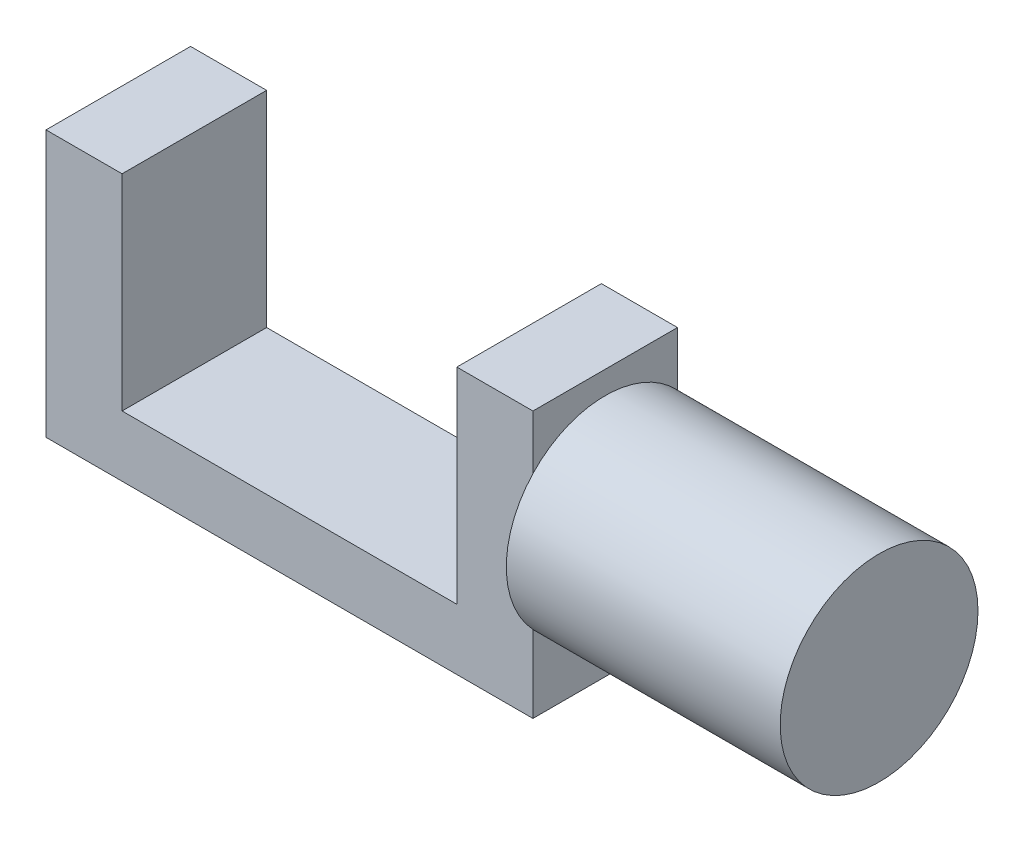
from build123d import *

# Parameters (mm, degrees)
SKETCH_1_W      = 32
SKETCH_1_H      = 9.5
EXTRUDE_1_DEPTH = 4
SKETCH_2_W      = 5
SKETCH_2_H      = 9.5
EXTRUDE_2_DEPTH = 13.5
SKETCH_3_W      = 5
SKETCH_3_H      = 9.5
EXTRUDE_3_DEPTH = 13.5
SKETCH_4_R      = 6.5
EXTRUDE_4_DEPTH = 18


with BuildPart() as part:
    # 草图1 → 凸台-拉伸1 (new body)
    with BuildSketch(Plane(origin=(0, 0, 0), x_dir=(1, 0, 0), z_dir=(0, 1, 0))):
        with Locations((16, -4.75)):
            Rectangle(SKETCH_1_W, SKETCH_1_H)
    extrude(amount=EXTRUDE_1_DEPTH)

    # 草图2 → 凸台-拉伸2 (add)
    with BuildSketch(Plane(origin=(0, 4, 0), x_dir=(1, 0, 0), z_dir=(0, 1, 0))):
        with Locations((2.5, -4.75)):
            Rectangle(SKETCH_2_W, SKETCH_2_H)
    extrude(amount=EXTRUDE_2_DEPTH)

    # 草图3 → 凸台-拉伸3 (add)
    with BuildSketch(Plane(origin=(0, 4, 0), x_dir=(1, 0, 0), z_dir=(0, 1, 0))):
        with Locations((29.5, -4.75)):
            Rectangle(SKETCH_3_W, SKETCH_3_H)
    extrude(amount=EXTRUDE_3_DEPTH)

    # 草图4 → 凸台-拉伸4 (add)
    with BuildSketch(Plane(origin=(32, 0, 0), x_dir=(0, 0, -1), z_dir=(1, 0, 0))):
        with Locations(Location((-4.75, 9.5, 0), (0, 0, 136.9509202))):
            Circle(SKETCH_4_R)
    extrude(amount=EXTRUDE_4_DEPTH)


solid = part.part
